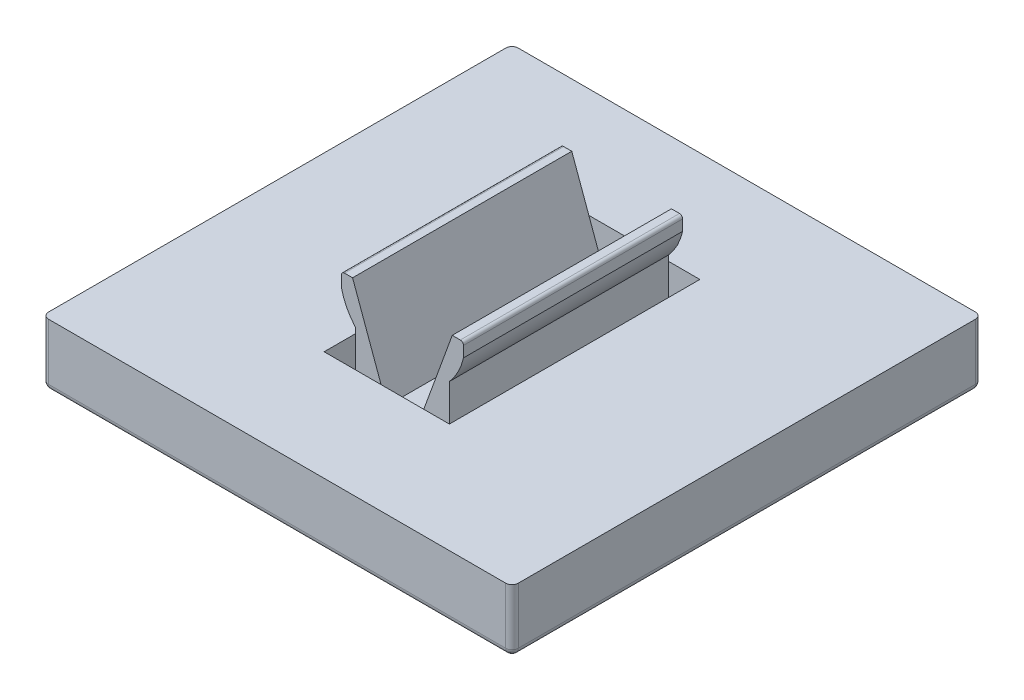
from build123d import *

# Parameters (mm, degrees)
SKETCH_1_W           = 15
SKETCH_1_H           = 15
EXTRUDE_1_DEPTH      = 2
SKETCH_2_W           = 4
SKETCH_2_H           = 8
CUT_EXTRUDE_1_DEPTH  = 1
EXTRUDE_2_DEPTH      = 3.5
EXTRUDE_2_DEPTH_BACK = 3.5
FILLET_1_R           = 0.1
FILLET_2_R           = 0.2


with BuildPart() as part:
    # 草图1 → 凸台-拉伸1 (new body)
    with BuildSketch(Plane(origin=(0, 0, 0), x_dir=(1, 0, 0), z_dir=(0, 1, 0))):
        Rectangle(SKETCH_1_W, SKETCH_1_H)
    extrude(amount=EXTRUDE_1_DEPTH)

    # 草图2 → 切除-拉伸1 (cut)
    with BuildSketch(Plane(origin=(0, 2, 0), x_dir=(1, 0, 0), z_dir=(0, 1, 0))):
        Rectangle(SKETCH_2_W, SKETCH_2_H)
    extrude(amount=-CUT_EXTRUDE_1_DEPTH, mode=Mode.SUBTRACT)

    # 草图3 → 凸台-拉伸2 (add, two sides: drawn at the far end of the back side and taken through both)
    with BuildSketch(Plane.XY.offset(-EXTRUDE_2_DEPTH_BACK)):
        with BuildLine():
            Line((-0.5, 1), (-1.5, 1))
            Line((-1.5, 1), (-1.5, 2.677124344))
            ThreePointArc((-1.5, 2.677124344), (-1.780042303, 3.088161527), (-1.95, 3.555590279))
            Line((-1.95, 3.555590279), (-1.95, 4))
            Line((-1.95, 4), (-1.591910703, 4))
            Line((-1.591910703, 4), (-0.5, 1))
        make_face()
        with BuildLine():
            Line((1.591910703, 4), (1.95, 4))
            Line((1.95, 4), (1.95, 3.555590279))
            ThreePointArc((1.95, 3.555590279), (1.780042303, 3.088161527), (1.5, 2.677124344))
            Line((1.5, 2.677124344), (1.5, 1))
            Line((1.5, 1), (0.5, 1))
            Line((0.5, 1), (1.591910703, 4))
        make_face()
    extrude(amount=EXTRUDE_2_DEPTH + EXTRUDE_2_DEPTH_BACK)

    # 圆角1
    fillet_1_edges = [part.edges().sort_by_distance(p)[0] for p in [
        (-1.95, 4, 0),
        (1.95, 4, 0),
    ]]
    fillet(fillet_1_edges, radius=FILLET_1_R)

    # 圆角2
    fillet_2_edges = [part.edges().sort_by_distance(p)[0] for p in [
        (7.5, 0, 0),
        (0, 0, 7.5),
        (-7.5, 0, 0),
        (0, 0, -7.5),
        (7.5, 1, -7.5),
        (7.5, 1, 7.5),
        (-7.5, 1, 7.5),
        (-7.5, 1, -7.5),
    ]]
    fillet(fillet_2_edges, radius=FILLET_2_R)


solid = part.part
